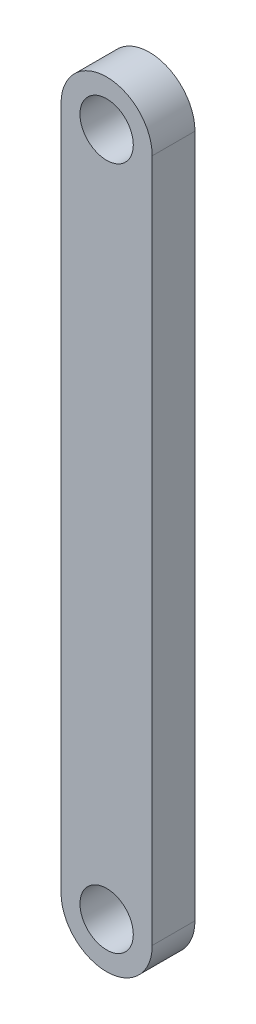
from build123d import *

# Parameters (mm, degrees)
SKETCH1_R           = 1.872
BOSS_EXTRUDE1_DEPTH = 3


with BuildPart() as part:
    # Sketch1 → Boss-Extrude1 (new body)
    with BuildSketch(Plane.XY):
        with BuildLine():
            Line((-3.2, 48), (-3.2, 0))
            ThreePointArc((-3.2, 0), (0, -3.2), (3.2, 0))
            Line((3.2, 0), (3.2, 48))
            ThreePointArc((3.2, 48), (0, 51.2), (-3.2, 48))
        make_face()
        Circle(SKETCH1_R, mode=Mode.SUBTRACT)
        with Locations((0, 48)):
            Circle(SKETCH1_R, mode=Mode.SUBTRACT)
    extrude(amount=BOSS_EXTRUDE1_DEPTH)


solid = part.part
